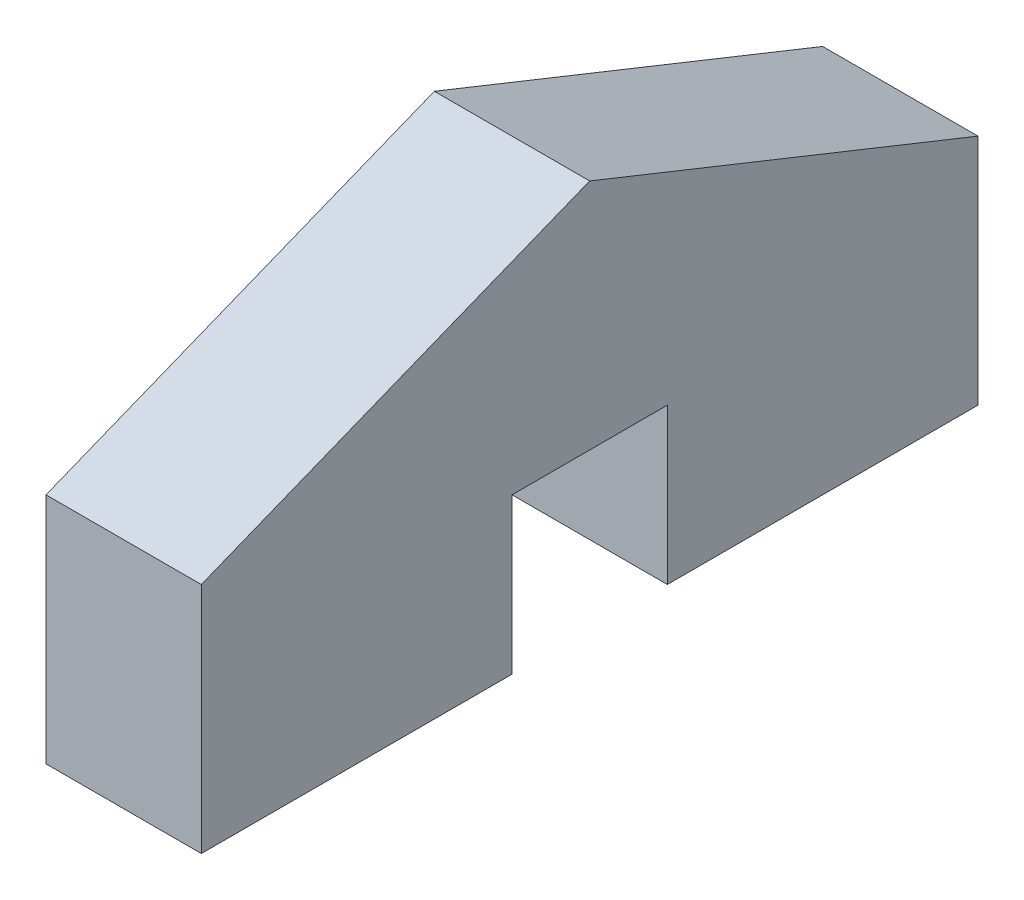
from build123d import *

# Parameters (mm, degrees)
BOSS_EXTRUDE4_DEPTH = 20


with BuildPart() as part:
    # Sketch1 → Boss-Extrude4 (new body)
    with BuildSketch(Plane(origin=(0, 0, 0), x_dir=(0, 0, -1), z_dir=(1, 0, 0))):
        Polygon((0, 0), (40, 0), (40, 20), (60, 20), (60, 0), (100, 0), (100, 30), (50, 50), (0, 30), align=None)
    extrude(amount=BOSS_EXTRUDE4_DEPTH)


solid = part.part
